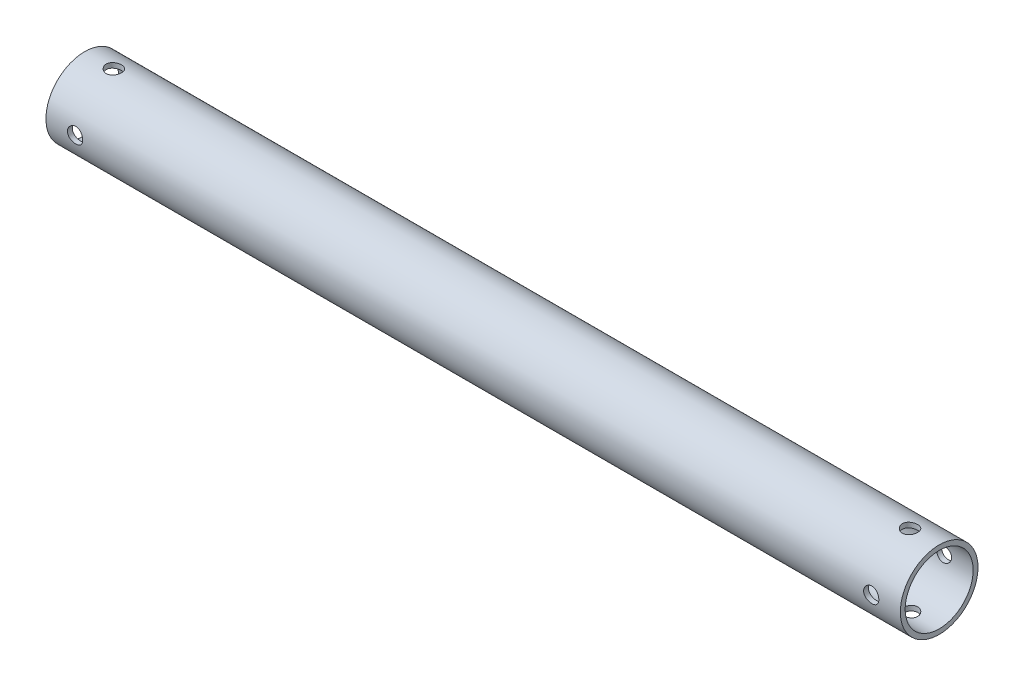
from build123d import *

# Parameters (mm, degrees)
SKETCH1_R               = 12.7
SKETCH1_R_2             = 11.1125
EXTRUDE_THIN1_DEPTH     = 139.7
CUT_EXTRUDE1_DEPTH      = 141.849813631
CUT_EXTRUDE1_DEPTH_BACK = 141.849813631
SKETCH3_R               = 2.4892
CUT_EXTRUDE2_DEPTH      = 141.849813749
CUT_EXTRUDE2_DEPTH_BACK = 141.849813749
SKETCH4_R               = 2.4892


with BuildPart() as part:
    # Sketch1 → Extrude-Thin1 (new, symmetric)
    with BuildSketch(Plane(origin=(0, 0, 0), x_dir=(0, 0, -1), z_dir=(1, 0, 0))):
        Circle(SKETCH1_R)
        Circle(SKETCH1_R_2, mode=Mode.SUBTRACT)
    extrude(amount=EXTRUDE_THIN1_DEPTH, both=True)

    # Sketch3 → Cut-Extrude1 (cut, two sides: drawn at the far end of the back side and taken through both)
    with BuildSketch(Plane.XY.offset(-CUT_EXTRUDE1_DEPTH_BACK)):
        with Locations((130.175, 0)):
            Circle(SKETCH3_R)
        with Locations((-130.175, 0)):
            Circle(SKETCH3_R)
    extrude(amount=CUT_EXTRUDE1_DEPTH + CUT_EXTRUDE1_DEPTH_BACK, mode=Mode.SUBTRACT)

    # Sketch4 → Cut-Extrude2 (cut, two sides: drawn at the far end of the back side and taken through both)
    with BuildSketch(Plane(origin=(0, 0, 0), x_dir=(1, 0, 0), z_dir=(0, 1, 0)).offset(-CUT_EXTRUDE2_DEPTH_BACK)):
        with Locations(Location((130.175, 0, 0), (0, 0, 270))):
            Circle(SKETCH4_R)
        with Locations(Location((-130.175, 0, 0), (0, 0, 270))):
            Circle(SKETCH4_R)
    extrude(amount=CUT_EXTRUDE2_DEPTH + CUT_EXTRUDE2_DEPTH_BACK, mode=Mode.SUBTRACT)


solid = part.part
